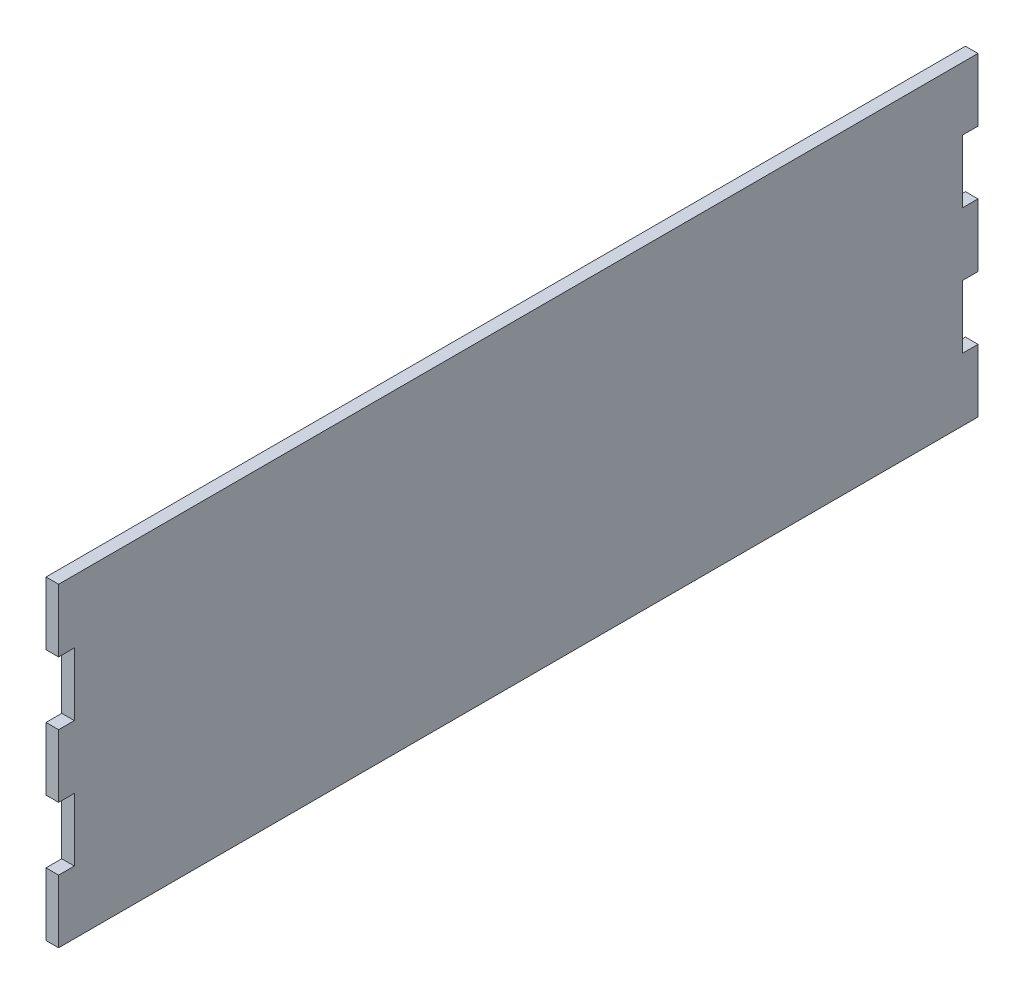
from build123d import *

# Parameters (mm, degrees)
BOSS_EXTRUDE1_DEPTH = 4


with BuildPart() as part:
    # Sketch1 → Boss-Extrude1 (new body)
    with BuildSketch(Plane(origin=(0, 0, 0), x_dir=(0, 0, -1), z_dir=(1, 0, 0))):
        Polygon((-147, 47.961970996), (145, 47.961970996), (145, 27.961970996), (140, 27.961970996), (140, 7.961970996), (145, 7.961970996), (145, -12.038029004), (140, -12.038029004), (140, -32.038029004), (145, -32.038029004), (145, -52.038029004), (-147, -52.038029004), (-147, -32.038029004), (-142, -32.038029004), (-142, -12.038029004), (-147, -12.038029004), (-147, 7.961970996), (-142, 7.961970996), (-142, 27.961970996), (-147, 27.961970996), align=None)
    extrude(amount=BOSS_EXTRUDE1_DEPTH)


solid = part.part
